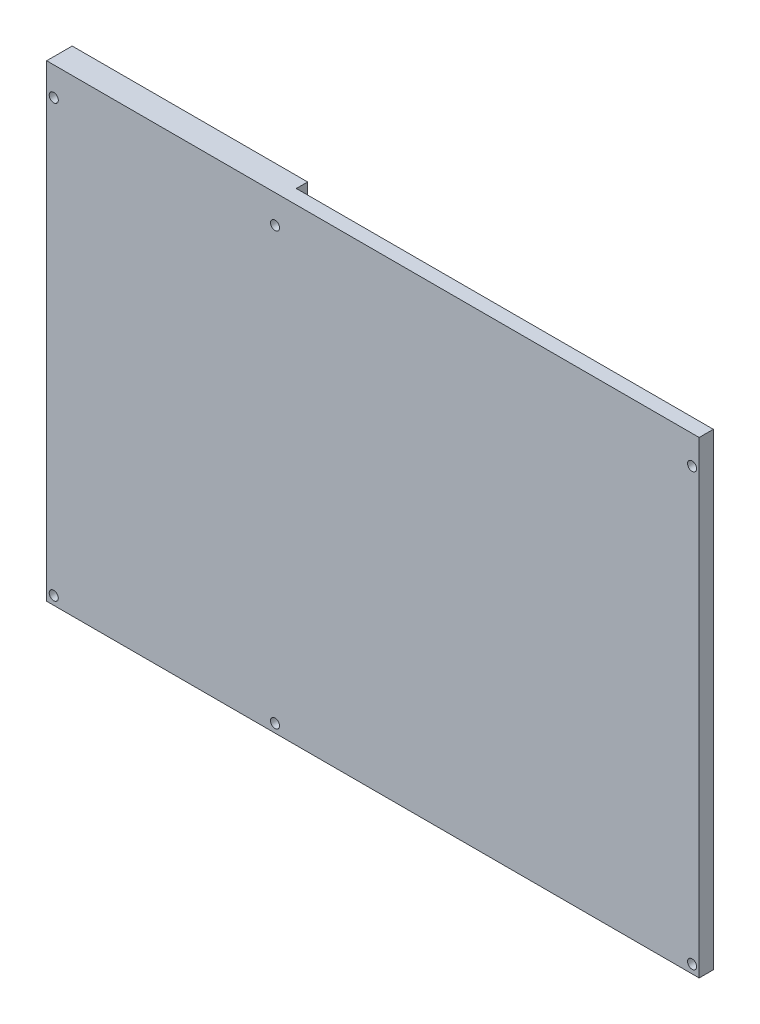
from build123d import *

# Parameters (mm, degrees)
EXTRUDE_1_DEPTH     = 165
SKETCH_2_R          = 1.6
CUT_EXTRUDE_1_DEPTH = 284.20663834


with BuildPart() as part:
    # 草图1 → 凸台-拉伸1 (new body)
    with BuildSketch(Plane(origin=(0, 0, 0), x_dir=(1, 0, 0), z_dir=(0, 1, 0))):
        Polygon((0, 0), (83, 0), (83, -4), (230, -4), (230, -9), (83, -9), (0, -9), align=None)
    extrude(amount=EXTRUDE_1_DEPTH)

    # 草图2 → 切除-拉伸1 (cut, through all)
    with BuildSketch(Plane.XY.offset(9)):
        with Locations((227.5, 3)):
            Circle(SKETCH_2_R)
        with Locations((227.5, 155)):
            Circle(SKETCH_2_R)
        with Locations((80.5, 155)):
            Circle(SKETCH_2_R)
        with Locations((80.5, 3)):
            Circle(SKETCH_2_R)
        with Locations((2.5, 155)):
            Circle(SKETCH_2_R)
        with Locations((2.5, 3)):
            Circle(SKETCH_2_R)
    extrude(amount=-CUT_EXTRUDE_1_DEPTH, mode=Mode.SUBTRACT)


solid = part.part
